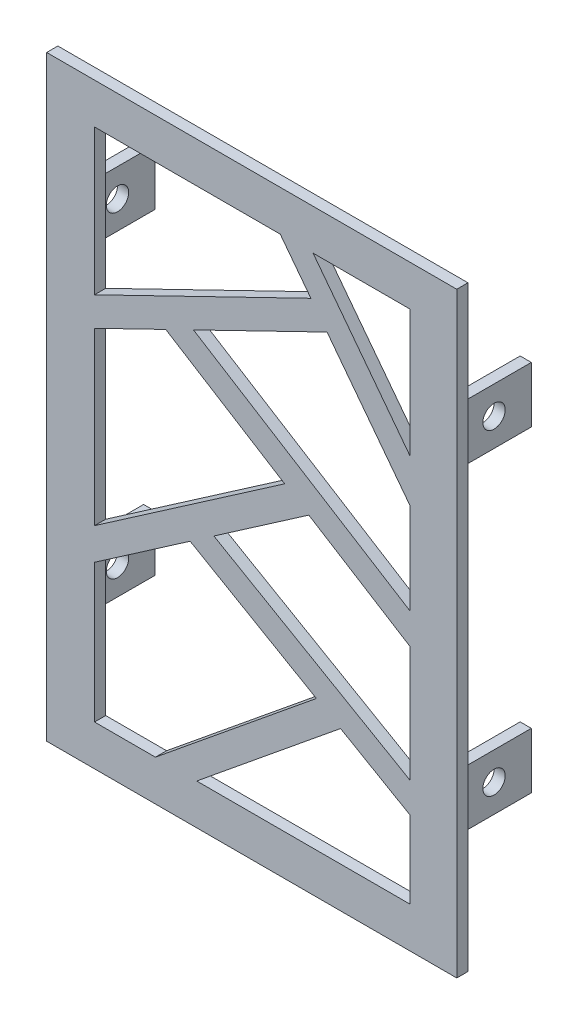
from build123d import *

# Parameters (mm, degrees)
SKETCH1_W           = 110
SKETCH1_H           = 160
BOSS_EXTRUDE1_DEPTH = 3
SKETCH2_W           = 3
SKETCH2_H           = 15
BOSS_EXTRUDE2_DEPTH = 20
FILLET1_R           = 5
SKETCH3_R           = 3
CUT_EXTRUDE1_DEPTH  = 120
CUT_EXTRUDE2_DEPTH  = 10


with BuildPart() as part:
    # Sketch1 → Boss-Extrude1 (new body)
    with BuildSketch(Plane.XY):
        with Locations((55, 80)):
            Rectangle(SKETCH1_W, SKETCH1_H)
    extrude(amount=BOSS_EXTRUDE1_DEPTH)

    # Sketch2 → Boss-Extrude2 (add)
    with BuildSketch(Plane(origin=(0, 0, 0), x_dir=(-1, 0, 0), z_dir=(0, 0, -1))):
        with Locations((-4.5, 122.5)):
            Rectangle(SKETCH2_W, SKETCH2_H)
        with Locations((-4.5, 37.5)):
            Rectangle(SKETCH2_W, SKETCH2_H)
        with Locations((-105.5, 37.5)):
            Rectangle(SKETCH2_W, SKETCH2_H)
        with Locations((-105.5, 122.5)):
            Rectangle(SKETCH2_W, SKETCH2_H)
    extrude(amount=BOSS_EXTRUDE2_DEPTH)

    # Fillet1
    fillet1_edges = [part.edges().sort_by_distance(p)[0] for p in [
        (6, 122.5, 0),
        (6, 37.5, 0),
        (104, 37.5, 0),
        (104, 122.5, 0),
    ]]
    fillet(fillet1_edges, radius=FILLET1_R)

    # Sketch3 → Cut-Extrude1 (cut)
    with BuildSketch(Plane(origin=(107, 0, 0), x_dir=(0, 0, -1), z_dir=(1, 0, 0))):
        with Locations((10, 122.5)):
            Circle(SKETCH3_R)
        with Locations((10, 37.5)):
            Circle(SKETCH3_R)
    extrude(amount=-CUT_EXTRUDE1_DEPTH, mode=Mode.SUBTRACT)

    # Sketch4 → Cut-Extrude2 (cut)
    with BuildSketch(Plane(origin=(0, 0, 0), x_dir=(-1, 0, 0), z_dir=(0, 0, -1))):
        Polygon((-97.404603448, 115.083332467), (-71.456820791, 149.11710788), (-97.404603448, 149.11710788), align=None)
        Polygon((-39.377270954, 115.240473699), (-75.208928564, 132.650284128), (-97.404603448, 103.53786924), (-97.404603448, 79.025613644), align=None)
        Polygon((-12.834970583, 149.11710788), (-62.654412981, 149.11710788), (-70.879295193, 138.329141999), (-12.834970583, 110.126687653), align=None)
        Polygon((-12.834970583, 56.494500283), (-12.834970583, 102.344156626), (-31.943432736, 111.628536023), (-63.844562164, 91.719040132), align=None)
        Polygon((-70.31535921, 87.68061549), (-97.404603448, 70.774217299), (-97.404603448, 39.706571637), (-44.85383039, 70.098223458), align=None)
        Polygon((-78.83079022, 42.362019492), (-97.404603448, 31.620239081), (-97.404603448, 10.88289212), (-40.243023437, 10.88289212), align=None)
        Polygon((-12.834970583, 10.88289212), (-12.834970583, 47.98768369), (-38.481002615, 65.697483931), (-72.350817961, 46.109577315), (-29.169217126, 10.88289212), align=None)
    extrude(amount=-CUT_EXTRUDE2_DEPTH, mode=Mode.SUBTRACT)


solid = part.part
